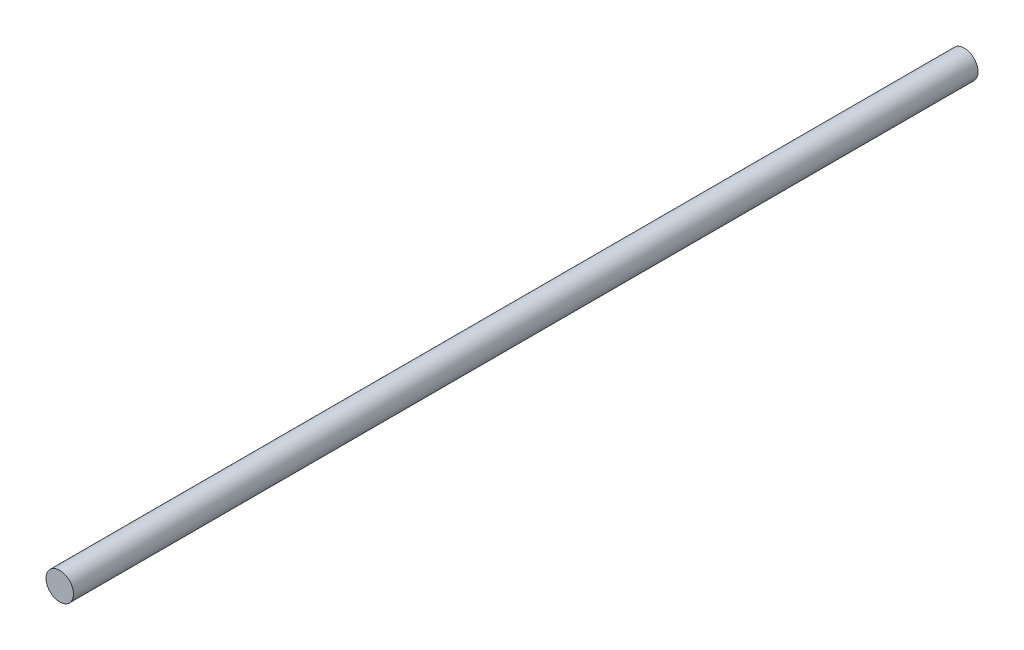
from build123d import *

# Parameters (mm, degrees)
SKETCH1_R           = 2.5
BOSS_EXTRUDE1_DEPTH = 164.7


with BuildPart() as part:
    # Sketch1 → Boss-Extrude1 (new body)
    with BuildSketch(Plane.XY):
        with Locations(Location((0, 0, 0), (0, 0, 180))):
            Circle(SKETCH1_R)
    extrude(amount=BOSS_EXTRUDE1_DEPTH)


solid = part.part
